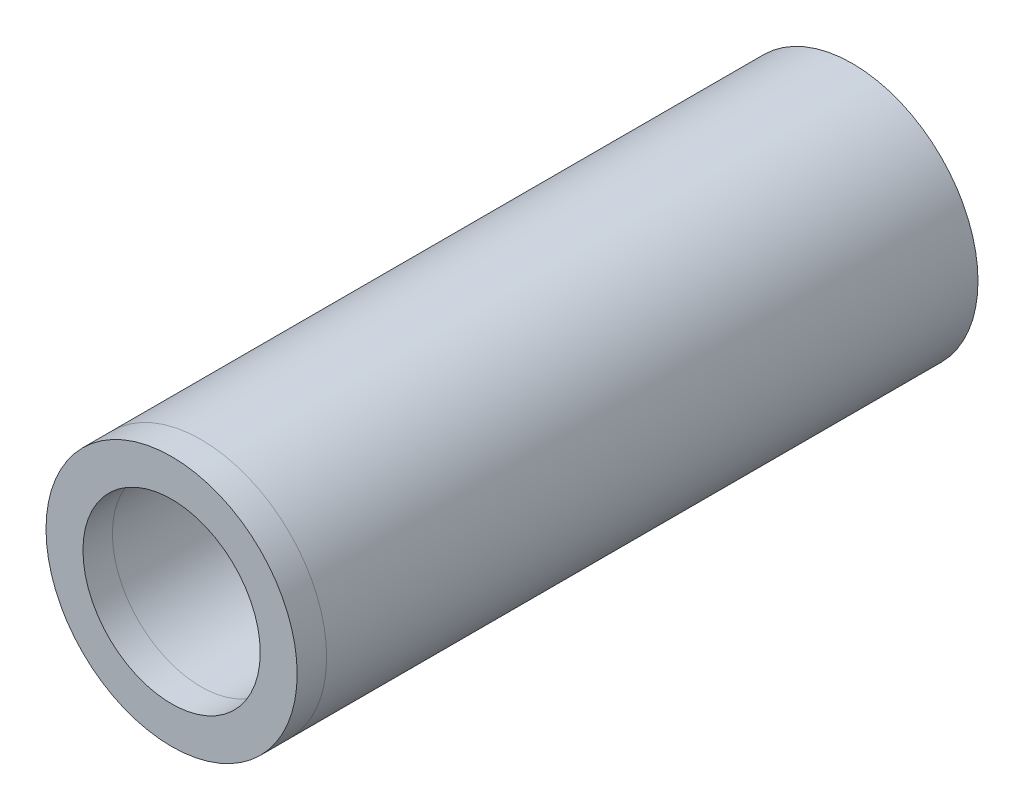
from build123d import *

# Parameters (mm, degrees)
SWEEP1_PROFILE_R     = 13.49375
CUT_SWEEP1_PROFILE_R = 9.525


with BuildPart() as part:
    # Sweep1: sweep along a curve in space
    with BuildLine() as sweep1_path:
        Line((0, 0, 0), (0, 0, 69.984404801))
        Line((0, 0, 69.984404801), (0, 0, 73.150434189))
    # Sweep1 profile (on start of the path) → Sweep1 (sweep)
    with BuildSketch(Plane.XY):
        Circle(SWEEP1_PROFILE_R)
    sweep(path=sweep1_path.line)

    # Cut-Sweep1: sweep along a curve in space
    with BuildLine() as cut_sweep1_path:
        Line((0, 0, 0), (0, 0, 69.984404801))
        Line((0, 0, 69.984404801), (0, 0, 73.150434189))
    # Cut-Sweep1 profile (on start of the path) → Cut-Sweep1 (sweep, cut)
    with BuildSketch(Plane.XY):
        Circle(CUT_SWEEP1_PROFILE_R)
    sweep(path=cut_sweep1_path.line, mode=Mode.SUBTRACT)


solid = part.part
